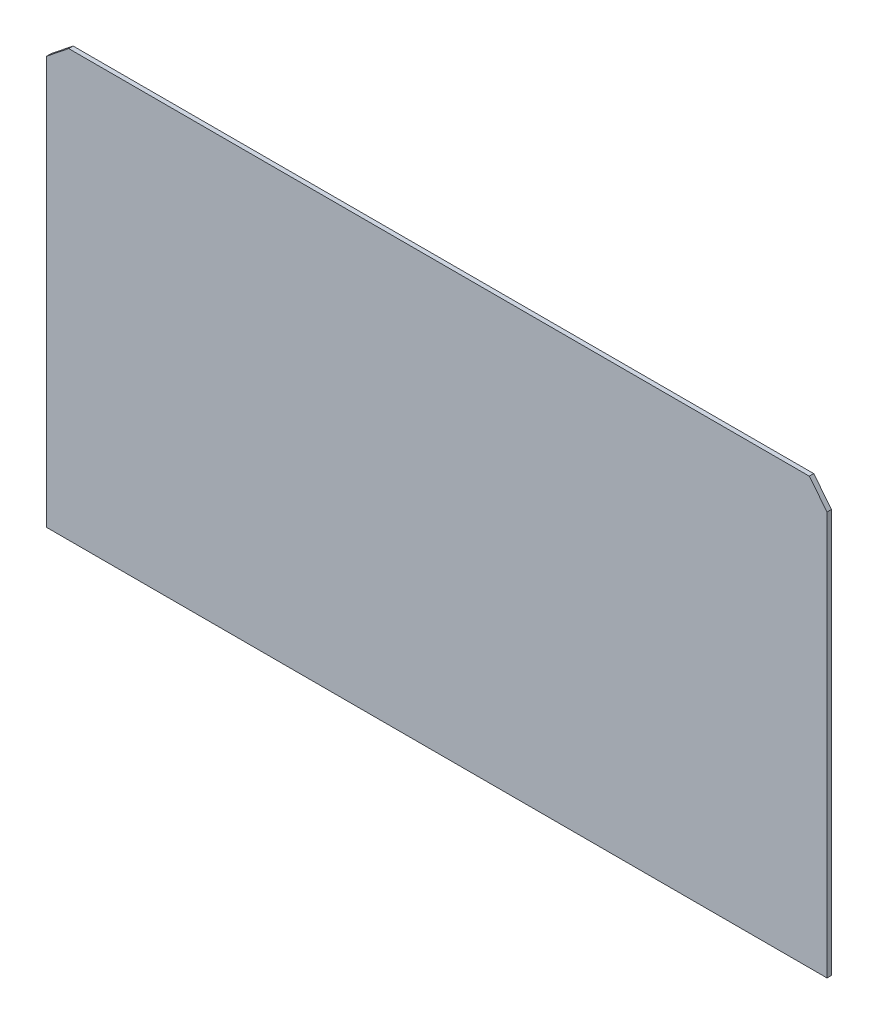
from build123d import *
from OCP.BRepFilletAPI import BRepFilletAPI_MakeChamfer

# Parameters (mm, degrees)
SKETCH1_W           = 558.8
SKETCH1_H           = 304.8
BOSS_EXTRUDE1_DEPTH = 3.175
CHAMFER1_SIZE       = 15.875
CHAMFER1_SIZE2      = 12.7


with BuildPart() as part:
    # Sketch1 → Boss-Extrude1 (new body)
    with BuildSketch(Plane.XY):
        with Locations((279.4, 152.4)):
            Rectangle(SKETCH1_W, SKETCH1_H)
    extrude(amount=BOSS_EXTRUDE1_DEPTH)

    # Chamfer1: one chamfer whose edges measure the first distance from different faces: ONE call of the kernel's chamfer builder (chamfer() names one face for all edges)
    chamfer1_edges_1 = [part.edges().sort_by_distance(p)[0] for p in [
        (0, 304.8, 1.5875),
    ]]
    chamfer1_side_1 = [part.faces().sort_by_distance(p)[0] for p in [
        (279.4, 304.8, 1.5875),
    ]]
    chamfer1_edges_2 = [part.edges().sort_by_distance(p)[0] for p in [
        (558.8, 304.8, 1.5875),
    ]]
    chamfer1_side_2 = [part.faces().sort_by_distance(p)[0] for p in [
        (558.8, 152.4, 1.5875),
    ]]
    chamfer1 = BRepFilletAPI_MakeChamfer(part.part.solid().wrapped)
    for e in chamfer1_edges_1:
        chamfer1.Add(CHAMFER1_SIZE, CHAMFER1_SIZE2, e.wrapped, chamfer1_side_1[0].wrapped)  # the first distance lies on this face
    for e in chamfer1_edges_2:
        chamfer1.Add(CHAMFER1_SIZE, CHAMFER1_SIZE2, e.wrapped, chamfer1_side_2[0].wrapped)  # the first distance lies on this face
    add(Compound.cast(chamfer1.Shape()), mode=Mode.REPLACE)


solid = part.part
